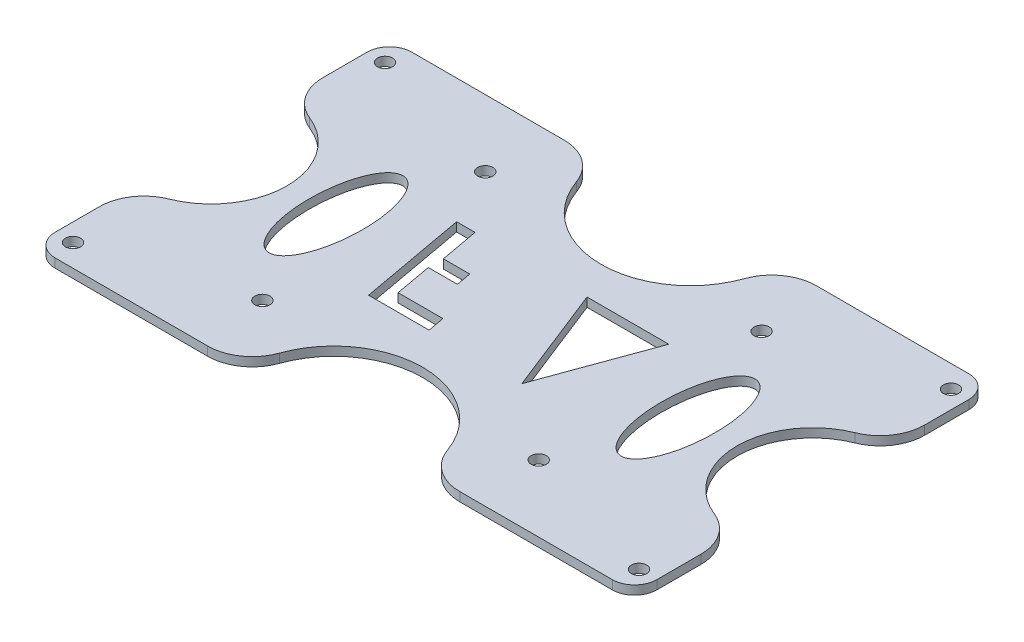
from build123d import *

# Parameters (mm, degrees)
EXTRUDE_1_DEPTH     = 2
SKETCH_2_R          = 1.7
CUT_EXTRUDE_1_DEPTH = 2
SKETCH_3_R          = 1.7
CUT_EXTRUDE_2_DEPTH = 3
SKETCH_4_RX         = 15
SKETCH_4_RY         = 6
CUT_EXTRUDE_3_DEPTH = 3
FILLET_1_R          = 5
FILLET_2_R          = 10
CUT_EXTRUDE_5_DEPTH = 3


with BuildPart() as part:
    # 草图1 → 凸台-拉伸1 (new body)
    with BuildSketch(Plane(origin=(0, 0, 0), x_dir=(1, 0, 0), z_dir=(0, 1, 0))):
        Polygon((-10.5, -40), (25.5, -40), (67.5, -40), (67.5, -20), (67.5, 20), (67.5, 40), (25.5, 40), (-10.5, 40), (-67.5, 40), (-67.5, 20), (-67.5, -20), (-67.5, -40), align=None)
    extrude(amount=EXTRUDE_1_DEPTH)

    # 草图2 → 切除-拉伸1 (cut)
    with BuildSketch(Plane(origin=(0, 2, 0), x_dir=(1, 0, 0), z_dir=(0, 1, 0))):
        with Locations(Location((-63.5, 35, 0), (0, 0, 270))):
            Circle(SKETCH_2_R)
        with Locations(Location((63.5, 35, 0), (0, 0, 90))):
            Circle(SKETCH_2_R)
        with Locations(Location((63.5, -35, 0), (0, 0, 270))):
            Circle(SKETCH_2_R)
        with Locations(Location((-63.5, -35, 0), (0, 0, 90))):
            Circle(SKETCH_2_R)
    extrude(amount=-CUT_EXTRUDE_1_DEPTH, mode=Mode.SUBTRACT)

    # 草图3 → 切除-拉伸2 (cut)
    with BuildSketch(Plane(origin=(0, 2, 0), x_dir=(1, 0, 0), z_dir=(0, 1, 0))):
        with Locations(Location((-31, 25, 0), (0, 0, 270))):
            Circle(SKETCH_3_R)
        with Locations(Location((31, 25, 0), (0, 0, 270))):
            Circle(SKETCH_3_R)
        with Locations(Location((-31, -25, 0), (0, 0, 270))):
            Circle(SKETCH_3_R)
        with Locations(Location((31, -25, 0), (0, 0, 270))):
            Circle(SKETCH_3_R)
    extrude(amount=-CUT_EXTRUDE_2_DEPTH, mode=Mode.SUBTRACT)

    # 草图4 → 切除-拉伸3 (cut)
    with BuildSketch(Plane(origin=(0, 2, 0), x_dir=(1, 0, 0), z_dir=(0, 1, 0))):
        with Locations(Location((-39.5, 0), (0, 0, -90))):
            Ellipse(SKETCH_4_RX, SKETCH_4_RY)
        with Locations(Location((39.5, 0), (0, 0, -90))):
            Ellipse(SKETCH_4_RX, SKETCH_4_RY)
        with BuildLine():
            Line((-67.5, 17), (-67.5, -17))
            ThreePointArc((-67.5, -17), (-50.5, 0), (-67.5, 17))
        make_face()
        with BuildLine():
            Line((67.5, 17), (67.5, -17))
            ThreePointArc((67.5, -17), (50.5, 0), (67.5, 17))
        make_face()
        with BuildLine():
            Line((-20, 40), (20, 40))
            ThreePointArc((20, 40), (0, 20), (-20, 40))
        make_face()
        with BuildLine():
            Line((-20, -40), (20, -40))
            ThreePointArc((20, -40), (0, -20), (-20, -40))
        make_face()
    extrude(amount=-CUT_EXTRUDE_3_DEPTH, mode=Mode.SUBTRACT)

    # 圆角1
    fillet_1_edges = [part.edges().sort_by_distance(p)[0] for p in [
        (67.5, 1, -40),
        (67.5, 1, 40),
        (-67.5, 1, 40),
        (-67.5, 1, -40),
    ]]
    fillet(fillet_1_edges, radius=FILLET_1_R)

    # 圆角2
    fillet_2_edges = [part.edges().sort_by_distance(p)[0] for p in [
        (20, 1, -40),
        (-20, 1, -40),
        (-20, 1, 40),
        (20, 1, 40),
        (67.5, 1, 17),
        (67.5, 1, -17),
        (-67.5, 1, -17),
        (-67.5, 1, 17),
    ]]
    fillet(fillet_2_edges, radius=FILLET_2_R)

    # 草图6 → 切除-拉伸5 (cut)
    with BuildSketch(Plane.XZ):
        Polygon((-24.505396053, -12.076400213), (-20.097950719, 12.076400213), (-6.523019093, 12.076400213), (-7.216611088, 8.275516079), (-17.277185706, 8.275516079), (-18.787316377, 0), (-12.246898397, 0), (-12.865682091, -3.390934644), (-18.787316377, -3.390934644), (-20.37225535, -12.076400213), align=None)
        Polygon((14.28012288, 12.076400213), (4.76004096, -12.076400213), (23.095013546, -12.076400213), align=None)
    extrude(amount=-CUT_EXTRUDE_5_DEPTH, mode=Mode.SUBTRACT)


solid = part.part
